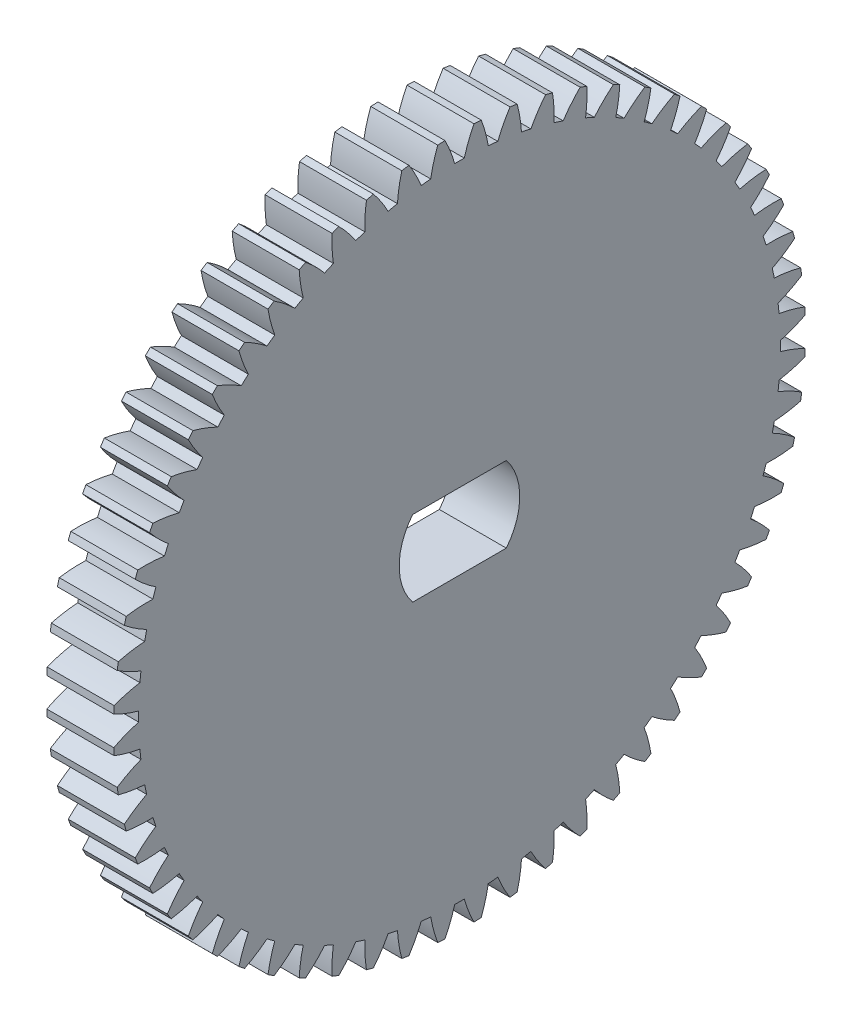
from build123d import *

# Parameters (mm, degrees)
BASPROSKE_W        = 3
BASPROSKE_H        = 15.5
TOOTHCUT_DEPTH     = 23.12464689
TEETHCUTS_COUNT    = 60
TEETHCUTS_ANGLE    = 354
BORSKE_R           = 0.5
BORE_DEPTH         = 50.0000508
CUT_EXTRUDE1_DEPTH = 10


with BuildPart() as part:
    # BasProSke → Base-Revolve (revolve)
    with BuildSketch(Plane(origin=(0, 0, 0), x_dir=(1, 0, 0), z_dir=(0, 1, 0)), mode=Mode.PRIVATE) as base_revolve_sk:
        with Locations((1.5, 7.75)):
            Rectangle(BASPROSKE_W, BASPROSKE_H)
    revolve(base_revolve_sk.sketch.rotate(Axis((-10, 0, 0), (1, 0, 0)), 180), axis=Axis((-10, 0, 0), (1, 0, 0)))

    # TooCutSke → ToothCut (cut, through all)
    with BuildSketch(Plane(origin=(0, 0, 0), x_dir=(0, 0, -1), z_dir=(1, 0, 0))):
        with BuildLine():
            ThreePointArc((0.21493681, 14.372392917), (0, 14.374), (-0.21493681, 14.372392917))
            ThreePointArc((-0.21493681, 14.372392917), (-0.409732631, 14.953266942), (-0.662749221, 15.51124781))
            ThreePointArc((-0.662749221, 15.51124781), (0, 15.5254), (0.662749221, 15.51124781))
            ThreePointArc((0.662749221, 15.51124781), (0.409732631, 14.953266942), (0.21493681, 14.372392917))
        make_face()
    toothcut = extrude(amount=TOOTHCUT_DEPTH, mode=Mode.SUBTRACT)

    # TeethCuts: ToothCut ×60 about axis
    teethcuts_axis = Axis((-10, 0, 0), (1, 0, 0))
    for i in range(1, TEETHCUTS_COUNT):
        add(toothcut.rotate(teethcuts_axis, i * TEETHCUTS_ANGLE / (TEETHCUTS_COUNT - 1)), mode=Mode.SUBTRACT)

    # BorSke → Bore (cut, symmetric)
    with BuildSketch(Plane(origin=(0, 0, 0), x_dir=(0, 0, -1), z_dir=(1, 0, 0))):
        with Locations(Location((0, 0, 0), (0, 0, 180))):
            Circle(BORSKE_R)
    extrude(amount=BORE_DEPTH, both=True, mode=Mode.SUBTRACT)

    # Sketch1 → Cut-Extrude1 (cut)
    # profile 1 of 2: a face of its own
    with BuildSketch(Plane(origin=(3, 0, 0), x_dir=(0, 0, -1), z_dir=(1, 0, 0))):
        with BuildLine():
            Line((2.097617696, -1.7), (-2.097617696, -1.7))
            ThreePointArc((-2.097617696, -1.7), (-2.7, 0), (-2.097617696, 1.7))
            Line((-2.097617696, 1.7), (2.097617696, 1.7))
            ThreePointArc((2.097617696, 1.7), (2.7, 0), (2.097617696, -1.7))
        make_face()
        with BuildLine():
            ThreePointArc((2, -1.5), (2.5, 0), (2, 1.5))
            Line((2, 1.5), (-2, 1.5))
            ThreePointArc((-2, 1.5), (-2.5, 0), (-2, -1.5))
            Line((-2, -1.5), (2, -1.5))
        make_face(mode=Mode.SUBTRACT)
    # profile 2 of 2: a face of its own
    with BuildSketch(Plane(origin=(3, 0, 0), x_dir=(0, 0, -1), z_dir=(1, 0, 0))):
        with BuildLine():
            Line((2, -1.5), (-2, -1.5))
            ThreePointArc((-2, -1.5), (-2.5, 0), (-2, 1.5))
            Line((-2, 1.5), (2, 1.5))
            ThreePointArc((2, 1.5), (2.5, 0), (2, -1.5))
        make_face()
    extrude(amount=-CUT_EXTRUDE1_DEPTH, mode=Mode.SUBTRACT)


solid = part.part
